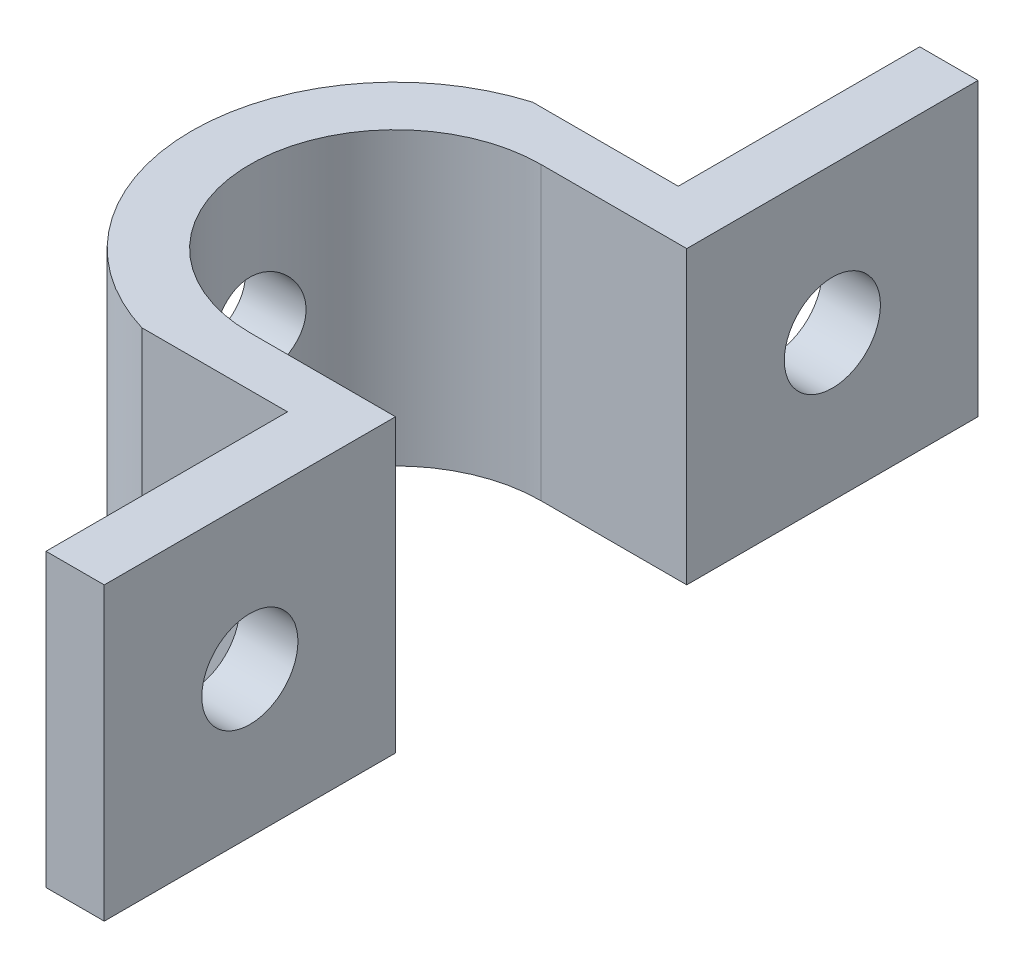
from build123d import *

# Parameters (mm, degrees)
EXTRUDE_1_DEPTH              = 10
HOLE_WIZARD_M3_2_D           = 2.5
HOLE_WIZARD_M3_2_CSINK_D     = 2.55
HOLE_WIZARD_M3_2_CSINK_ANGLE = 90
SKETCH_15_W                  = 10
SKETCH_15_H                  = 10
EXTRUDE_2_DEPTH              = 5
HOLE_WIZARD_M3_1_D           = 2.5
HOLE_WIZARD_M3_1_CSINK_D     = 2.55
HOLE_WIZARD_M3_1_CSINK_ANGLE = 90
SKETCH_21_W                  = 8.291796068
SKETCH_21_H                  = 10
CUT_EXTRUDE_2_DEPTH          = 5
SKETCH_23_R                  = 1.65
CUT_EXTRUDE_3_DEPTH          = 10
SKETCH_24_R                  = 1.65
CUT_EXTRUDE_4_DEPTH          = 10


with BuildPart() as part:
    # 草图1 → 凸台-拉伸1 (new body)
    with BuildSketch(Plane(origin=(0, 0, 0), x_dir=(1, 0, 0), z_dir=(0, 1, 0))):
        with BuildLine():
            Line((0, 0), (0, -10))
            ThreePointArc((0, -10), (-5, -15), (0, -20))
            Line((0, -20), (0, -30))
            Line((0, -30), (-2, -30))
            Line((-2, -30), (-2, -21.708203932))
            ThreePointArc((-2, -21.708203932), (-7, -15), (-2, -8.291796068))
            Line((-2, -8.291796068), (-2, 0))
            Line((-2, 0), (0, 0))
        make_face()
    extrude(amount=EXTRUDE_1_DEPTH)

    # M3 螺纹孔的螺纹孔钻头2 (through all)
    with Locations(Plane.ZY.offset(7)):
        with Locations((15, 5)):
            CounterSinkHole(HOLE_WIZARD_M3_2_D / 2, HOLE_WIZARD_M3_2_CSINK_D / 2, counter_sink_angle=HOLE_WIZARD_M3_2_CSINK_ANGLE)

    # 草图15 → 凸台-拉伸2 (add)
    with BuildSketch(Plane(origin=(0, 0, 0), x_dir=(0, 0, -1), z_dir=(1, 0, 0))):
        with Locations((-5, 5)):
            Rectangle(SKETCH_15_W, SKETCH_15_H)
        with Locations((-25, 5)):
            Rectangle(SKETCH_15_W, SKETCH_15_H)
    extrude(amount=EXTRUDE_2_DEPTH)

    # M3 螺纹孔的螺纹孔钻头1 (through all)
    with Locations(Plane(origin=(5, 0, 0), x_dir=(0, 0, -1), z_dir=(1, 0, 0))):
        with Locations((-5, 5), (-25, 5)):
            CounterSinkHole(HOLE_WIZARD_M3_1_D / 2, HOLE_WIZARD_M3_1_CSINK_D / 2, counter_sink_angle=HOLE_WIZARD_M3_1_CSINK_ANGLE)

    # 草图21 → 切除-拉伸2 (cut)
    with BuildSketch(Plane.ZY.offset(2)):
        with Locations((4.145898034, 5)):
            Rectangle(SKETCH_21_W, SKETCH_21_H)
        with Locations((25.854101966, 5)):
            Rectangle(SKETCH_21_W, SKETCH_21_H)
    extrude(amount=-CUT_EXTRUDE_2_DEPTH, mode=Mode.SUBTRACT)

    # 草图23 → 切除-拉伸3 (cut)
    with BuildSketch(Plane.ZY.offset(-3)):
        with Locations((25, 5)):
            Circle(SKETCH_23_R)
        with Locations((5, 5)):
            Circle(SKETCH_23_R)
    extrude(amount=-CUT_EXTRUDE_3_DEPTH, mode=Mode.SUBTRACT)

    # 草图24 → 切除-拉伸4 (cut)
    with BuildSketch(Plane.ZY.offset(7)):
        with Locations((15, 5)):
            Circle(SKETCH_24_R)
    extrude(amount=-CUT_EXTRUDE_4_DEPTH, mode=Mode.SUBTRACT)


solid = part.part
